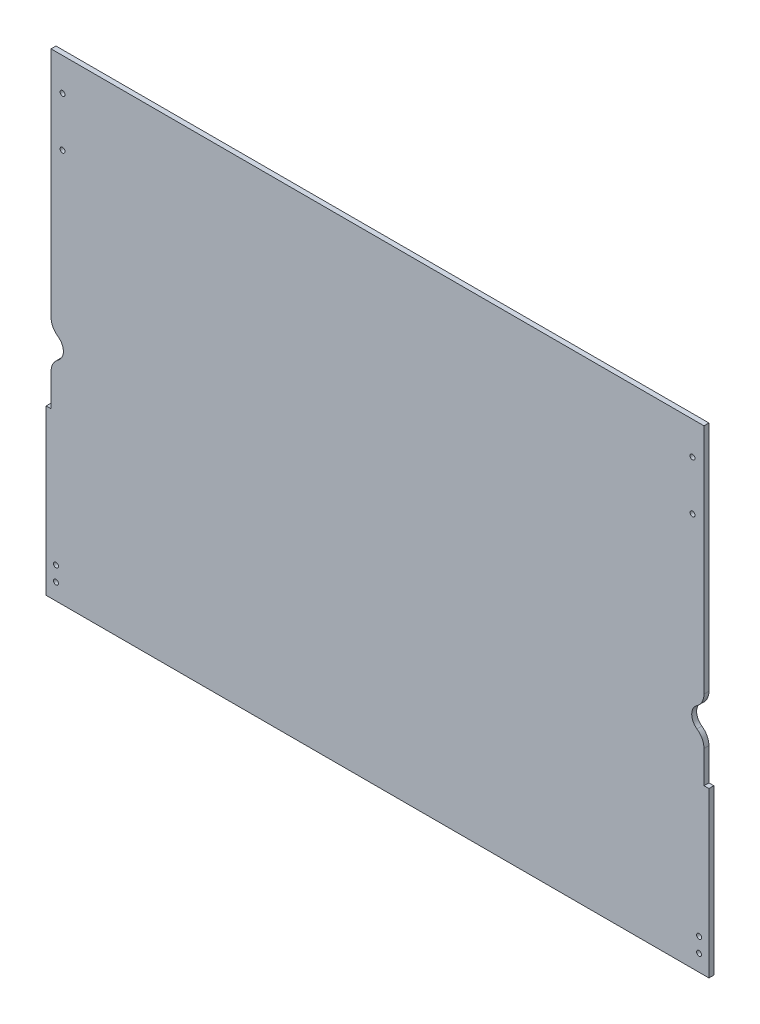
from build123d import *

# Parameters (mm, degrees)
EXTRUDE_1_DEPTH     = 3
SKETCH_2_R          = 1.5
CUT_EXTRUDE_1_DEPTH = 354.430332598
SKETCH_3_R          = 7.5
CUT_EXTRUDE_2_DEPTH = 354.430332598
FILLET_1_R          = 10


with BuildPart() as part:
    # 草图1 → 凸台-拉伸1 (new body)
    with BuildSketch(Plane.XY):
        Polygon((199, 290), (-199, 290), (-199, 100), (-202, 100), (-202, 0), (202, 0), (202, 100), (199, 100), align=None)
    extrude(amount=EXTRUDE_1_DEPTH)

    # 草图2 → 切除-拉伸1 (cut, through all)
    with BuildSketch(Plane.XY.offset(3)):
        with Locations((192, 270)):
            Circle(SKETCH_2_R)
        with Locations((192, 240)):
            Circle(SKETCH_2_R)
        with Locations(Location((-192, 240, 0), (0, 0, 180))):
            Circle(SKETCH_2_R)
        with Locations(Location((-192, 270, 0), (0, 0, 180))):
            Circle(SKETCH_2_R)
        with Locations((196, 19)):
            Circle(SKETCH_2_R)
        with Locations((196, 10)):
            Circle(SKETCH_2_R)
        with Locations(Location((-196, 10, 0), (0, 0, 180))):
            Circle(SKETCH_2_R)
        with Locations(Location((-196, 19, 0), (0, 0, 180))):
            Circle(SKETCH_2_R)
    extrude(amount=-CUT_EXTRUDE_1_DEPTH, mode=Mode.SUBTRACT)

    # 草图3 → 切除-拉伸2 (cut, through all)
    with BuildSketch(Plane.XY.offset(3)):
        with Locations((199, 134)):
            Circle(SKETCH_3_R)
        with Locations((-199, 134)):
            Circle(SKETCH_3_R)
    extrude(amount=-CUT_EXTRUDE_2_DEPTH, mode=Mode.SUBTRACT)

    # 圆角1
    fillet_1_edges = [part.edges().sort_by_distance(p)[0] for p in [
        (199, 126.5, 1.5),
        (199, 141.5, 1.5),
        (-199, 141.5, 1.5),
        (-199, 126.5, 1.5),
    ]]
    fillet(fillet_1_edges, radius=FILLET_1_R)


solid = part.part
